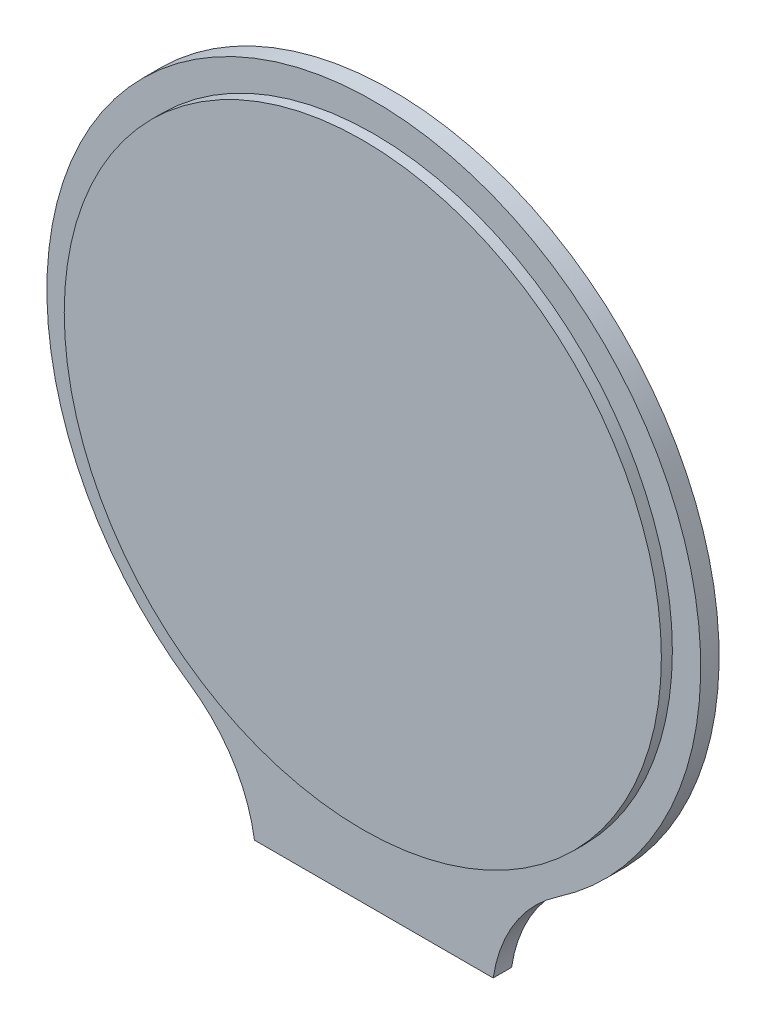
from build123d import *

# Parameters (mm, degrees)
BOSS_EXTRU_1_CONTOUR_CRAN_DEPTH = 1
CRAN_R                          = 16.256
BOSS_EXTRU_1_CRAN_DEPTH         = 0.6


with BuildPart() as part:
    # Contour_Écran → Boss.-Extru.1_Contour_Écran (new body)
    with BuildSketch(Plane.XY):
        with BuildLine():
            Line((-6.5, -20.3), (6.5, -20.3))
            ThreePointArc((6.5, -20.3), (7.668481961, -17.144005216), (10.005084126, -14.722034222))
            ThreePointArc((10.005084126, -14.722034222), (0, 17.8), (-10.005084126, -14.722034222))
            ThreePointArc((-10.005084126, -14.722034222), (-7.668481961, -17.144005216), (-6.5, -20.3))
        make_face()
    extrude(amount=BOSS_EXTRU_1_CONTOUR_CRAN_DEPTH)

    # cran → Boss.-Extru.1_Écran (add)
    with BuildSketch(Plane.XY.offset(1)):
        Circle(CRAN_R)
    extrude(amount=BOSS_EXTRU_1_CRAN_DEPTH)


solid = part.part
